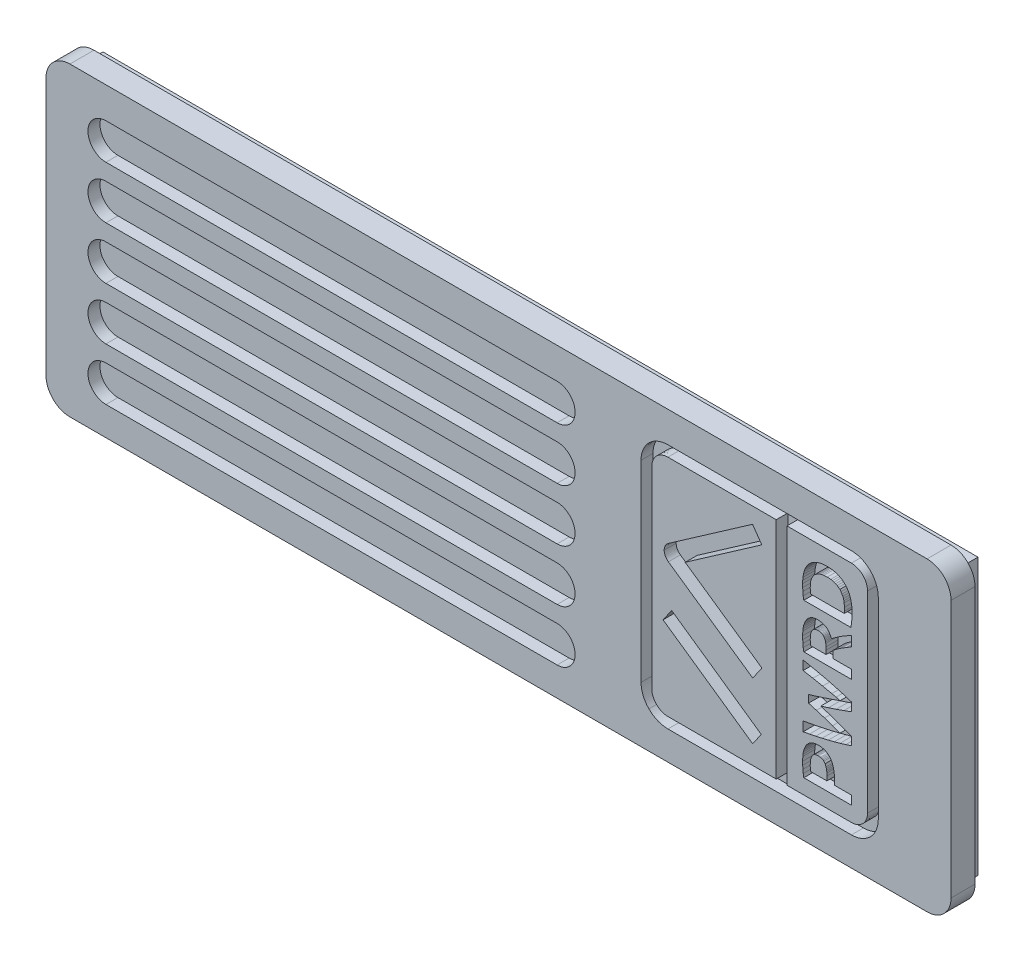
from build123d import *

# Parameters (mm, degrees)
SKETCH1_W           = 75.5
SKETCH1_H           = 25.5
BOSS_EXTRUDE1_DEPTH = 2
SKETCH2_W           = 73
SKETCH2_H           = 23
SKETCH2_W_2         = 72
SKETCH2_H_2         = 22
BOSS_EXTRUDE2_DEPTH = 1.5
FILLET1_R           = 2
CUT_EXTRUDE1_DEPTH  = 1
CUT_EXTRUDE5_DEPTH  = 1


with BuildPart() as part:
    # Sketch1 → Boss-Extrude1 (new body)
    with BuildSketch(Plane.XY):
        with Locations((2.625, -0.22972973)):
            Rectangle(SKETCH1_W, SKETCH1_H)
    extrude(amount=BOSS_EXTRUDE1_DEPTH)

    # Sketch2 → Boss-Extrude2 (add)
    with BuildSketch(Plane(origin=(0, 0, 0), x_dir=(-1, 0, 0), z_dir=(0, 0, -1))):
        with Locations((-2.625, -0.22972973)):
            Rectangle(SKETCH2_W, SKETCH2_H)
        with Locations((-2.625, -0.22972973)):
            Rectangle(SKETCH2_W_2, SKETCH2_H_2, mode=Mode.SUBTRACT)
    extrude(amount=BOSS_EXTRUDE2_DEPTH)

    # Fillet1
    fillet1_edges = [part.edges().sort_by_distance(p)[0] for p in [
        (-35.125, 12.52027027, 1),
        (40.375, 12.52027027, 1),
        (40.375, -12.97972973, 1),
        (-35.125, -12.97972973, 1),
    ]]
    fillet(fillet1_edges, radius=FILLET1_R)

    # Sketch4 → Cut-Extrude1 (cut)
    # profile 1 of 7: a face of its own
    with BuildSketch(Plane.XY.offset(2)):
        with BuildLine():
            Line((14.5143405, -8.334268667), (14.5143405, 7.712957333))
            add(Edge.make_bspline(
                [(14.5143405, 7.712957333), (14.5143405, 8.307731333), (14.7506135, 8.878144833), (15.171182, 9.298713833)],
                knots=[0, 0, 0, 0, 1, 1, 1, 1], degree=3))
            add(Edge.make_bspline(
                [(15.171182, 9.298713833), (15.591751, 9.719282333), (16.1621645, 9.955555333), (16.7569385, 9.955555333)],
                knots=[0, 0, 0, 0, 1, 1, 1, 1], degree=3))
            Line((16.7569385, 9.955555333), (32.063143, 9.955555333))
            add(Edge.make_bspline(
                [(32.063143, 9.955555333), (33.301695, 9.955553833), (34.3057385, 8.951508833), (34.3057385, 7.712957333)],
                knots=[0, 0, 0, 0, 1, 1, 1, 1], degree=3))
            Line((34.3057385, 7.712957333), (34.3057385, -8.334268667))
            add(Edge.make_bspline(
                [(34.3057385, -8.334268667), (34.3057385, -9.572820667), (33.301695, -10.576865667), (32.063143, -10.576866667)],
                knots=[0, 0, 0, 0, 1, 1, 1, 1], degree=3))
            Line((32.063143, -10.576866667), (16.7569385, -10.576866667))
            add(Edge.make_bspline(
                [(16.7569385, -10.576866667), (16.1621645, -10.576866667), (15.591751, -10.340593667), (15.171182, -9.920025167)],
                knots=[0, 0, 0, 0, 1, 1, 1, 1], degree=3))
            add(Edge.make_bspline(
                [(15.171182, -9.920025167), (14.7506135, -9.499456667), (14.5143405, -8.929042667), (14.5143405, -8.334268667)],
                knots=[0, 0, 0, 0, 1, 1, 1, 1], degree=3))
        make_face()
        with BuildLine():
            Line((26.690149, 9.058516333), (26.690149, -9.679827667))
            Line((26.690149, -9.679827667), (32.063143, -9.679827667))
            add(Edge.make_bspline(
                [(32.063143, -9.679827667), (32.8062735, -9.679826167), (33.4086995, -9.077399667), (33.4086995, -8.334268667)],
                knots=[0, 0, 0, 0, 1, 1, 1, 1], degree=3))
            Line((33.4086995, -8.334268667), (33.4086995, 7.712957333))
            add(Edge.make_bspline(
                [(33.4086995, 7.712957333), (33.4086995, 8.456087833), (32.8062735, 9.058514833), (32.063143, 9.058516333)],
                knots=[0, 0, 0, 0, 1, 1, 1, 1], degree=3))
            Line((32.063143, 9.058516333), (26.690149, 9.058516333))
        make_face(mode=Mode.SUBTRACT)
        with BuildLine():
            Line((25.79311, 9.058516333), (16.7569385, 9.058516333))
            add(Edge.make_bspline(
                [(16.7569385, 9.058516333), (16.400074, 9.058516333), (16.057826, 8.916752333), (15.8054845, 8.664411333)],
                knots=[0, 0, 0, 0, 1, 1, 1, 1], degree=3))
            add(Edge.make_bspline(
                [(15.8054845, 8.664411333), (15.5531435, 8.412069833), (15.4113795, 8.069821833), (15.4113795, 7.712957333)],
                knots=[0, 0, 0, 0, 1, 1, 1, 1], degree=3))
            Line((15.4113795, 7.712957333), (15.4113795, -8.334268667))
            add(Edge.make_bspline(
                [(15.4113795, -8.334268667), (15.4113795, -8.691133167), (15.5531435, -9.033381167), (15.8054845, -9.285722667)],
                knots=[0, 0, 0, 0, 1, 1, 1, 1], degree=3))
            add(Edge.make_bspline(
                [(15.8054845, -9.285722667), (16.057826, -9.538063667), (16.400074, -9.679827667), (16.7569385, -9.679827667)],
                knots=[0, 0, 0, 0, 1, 1, 1, 1], degree=3))
            Line((16.7569385, -9.679827667), (25.79311, -9.679827667))
            Line((25.79311, -9.679827667), (25.79311, 9.058516333))
        make_face(mode=Mode.SUBTRACT)
    # profile 2 of 7: a face of its own
    with BuildSketch(Plane.XY.offset(2)):
        Polygon((28.093961, -8.433520167), (28.0437265, -8.151121167), (28.0159185, -7.865589167), (28.001566, -7.578873167), (27.996031, -7.291834167), (28.0094865, -6.937736667), (28.0265305, -6.763371167), (28.0561325, -6.592225167), (28.1027785, -6.425307667), (28.1646745, -6.262406167), (28.2373345, -6.102208167), (28.315377, -5.943362667), (28.4170115, -5.836064167), (28.521786, -5.735226167), (28.632839, -5.647307167), (28.692044, -5.610214667), (28.7539395, -5.578755667), (28.8185265, -5.553046167), (28.8858045, -5.532405667), (29.0253835, -5.503431167), (29.170614, -5.486046667), (29.3187155, -5.474456667), (29.4759665, -5.482003667), (29.630526, -5.501989667), (29.7804215, -5.543836667), (29.9273565, -5.599686167), (30.04747, -5.671718167), (30.158434, -5.754138167), (30.2542375, -5.853792167), (30.3412505, -5.963736667), (30.419293, -6.101565167), (30.4865705, -6.243807667), (30.536805, -6.393027667), (30.5771715, -6.546242667), (30.611259, -6.741363167), (30.6363765, -6.937322167), (30.648935, -7.134592167), (30.6535275, -7.332608167), (30.6535275, -7.699578667), (32.0748135, -7.699578667), (32.0748135, -8.433520167), align=None)
        Polygon((28.7696555, -6.528767667), (28.732877, -6.604881167), (28.7014805, -6.682834167), (28.661114, -6.846228667), (28.636894, -7.042118167), (28.6293585, -7.239411667), (28.6327675, -7.469712167), (28.64712, -7.699581167), (30.021806, -7.699581167), (30.021806, -7.344260667), (30.0160555, -7.134187167), (30.0082605, -7.030123667), (29.994805, -6.927227167), (29.973276, -6.825868667), (29.9445705, -6.725997667), (29.8737045, -6.528770167), (29.764445, -6.399177667), (29.7043435, -6.344933667), (29.6370655, -6.303302167), (29.5626115, -6.275682167), (29.481878, -6.258889667), (29.3113505, -6.243353167), (29.225235, -6.247761167), (29.140913, -6.259736667), (29.0592825, -6.285086667), (28.979446, -6.319075667), (28.9166535, -6.361487667), (28.86014, -6.409362667), (28.812597, -6.466342667), align=None, mode=Mode.SUBTRACT)
    # profile 3 of 7: a face of its own
    with BuildSketch(Plane.XY.offset(2)):
        Polygon((28.487142, 7.186026833), (28.628067, 7.328279333), (28.701624, 7.394839333), (28.7796665, 7.455927833), (28.862194, 7.510378333), (28.94831, 7.559535833), (29.1275385, 7.649060333), (29.352426, 7.721989833), (29.4659015, 7.752668333), (29.580633, 7.776529833), (29.696889, 7.792496833), (29.814222, 7.802453833), (30.050771, 7.812142333), (30.28436, 7.802184833), (30.4002575, 7.792138333), (30.514989, 7.776081333), (30.628285, 7.752219833), (30.740325, 7.721630833), (30.9623425, 7.649060333), (31.1425575, 7.559132333), (31.2295705, 7.509794833), (31.312995, 7.455254833), (31.3919345, 7.394256333), (31.4663885, 7.327875333), (31.609287, 7.186044833), (31.732271, 7.019859333), (31.7887845, 6.934281333), (31.839916, 6.845654333), (31.884768, 6.753492333), (31.9242375, 6.658486833), (31.9942065, 6.463739833), (32.048926, 6.233218333), (32.09019, 6.000903333), (32.1108215, 5.765699833), (32.119164, 5.528836333), (32.1132345, 5.251992333), (32.098882, 4.975470833), (32.068383, 4.679618333), (32.0145605, 4.387147833), (28.0943825, 4.387147833), (28.04056, 4.682470833), (28.012752, 4.981283833), (28.0001935, 5.260765333), (27.9952865, 5.540479833), (28.003252, 5.774903333), (28.022987, 6.007792333), (28.062457, 6.238044833), (28.114485, 6.466645833), (28.181763, 6.660227333), (28.2194385, 6.754721333), (28.2624965, 6.846461333), (28.3118335, 6.934730333), (28.36745, 7.020128333), align=None)
        Polygon((28.629852, 5.587083833), (28.632337, 5.353817833), (28.6475865, 5.121089833), (31.4668545, 5.121089833), (31.4755915, 5.290011333), (31.478507, 5.575431333), (31.460566, 5.878836833), (31.439037, 6.026148833), (31.4031555, 6.168203833), (31.348436, 6.303387833), (31.276673, 6.432229333), (31.1932485, 6.556810333), (31.1034545, 6.679264833), (30.9862115, 6.764035333), (30.867085, 6.843512833), (30.744101, 6.912405333), (30.6154655, 6.965510333), (30.4803715, 7.000943333), (30.3403435, 7.022651833), (30.052035, 7.043283333), (29.763637, 7.024445833), (29.6234295, 7.003723833), (29.4880665, 6.969457333), (29.358893, 6.917697833), (29.2353705, 6.849971333), (29.115616, 6.771659833), (28.997745, 6.687966333), (28.908938, 6.565583333), (28.8264105, 6.441100833), (28.7555445, 6.312411833), (28.702619, 6.177461333), (28.6676345, 6.035818833), (28.6470025, 5.889072333), align=None, mode=Mode.SUBTRACT)
    # profile 4 of 7: a face of its own
    with BuildSketch(Plane.XY.offset(2)):
        Polygon((30.5462595, 1.859129833), (30.5462595, 1.393135833), (32.0723825, 1.393135833), (32.0723825, 0.659196333), (28.093961, 0.659196333), (28.0446235, 0.943162833), (28.0159185, 1.230036333), (28.001566, 1.500726833), (27.9958695, 1.771749333), (28.009325, 2.123110333), (28.026369, 2.296077333), (28.055971, 2.465797333), (28.1026175, 2.631247333), (28.164513, 2.792633833), (28.237173, 2.951283833), (28.3152155, 3.108570833), (28.414518, 3.213694833), (28.5167805, 3.312593333), (28.6251425, 3.399067833), (28.682553, 3.435667333), (28.7426545, 3.466794333), (28.8054475, 3.492359833), (28.8709315, 3.512902333), (29.007371, 3.541966333), (29.1492825, 3.559637833), (29.293975, 3.571658333), (29.485134, 3.542863333), (29.6695655, 3.504739333), (29.757475, 3.479263333), (29.8409, 3.447956833), (29.9189425, 3.409652833), (29.9916025, 3.363096833), (30.0579835, 3.307749333), (30.118085, 3.244508333), (30.1737015, 3.174449333), (30.2248325, 3.098739333), (30.3188425, 2.934903833), (30.405855, 2.762008833), (30.567053, 2.889702333), (30.7320185, 3.012479833), (30.9383375, 3.157934833), (31.148424, 3.297899833), (31.3764515, 3.441121333), (31.6086055, 3.577497833), (31.837709, 3.701755833), (32.0717465, 3.816307833), (32.0717465, 2.994996833), (31.8588795, 2.878578833), (31.6494205, 2.756168833), (31.2358855, 2.496960333), (31.0450855, 2.369571833), (30.857335, 2.237742833), (30.539873, 1.998924333), align=None)
        Polygon((28.7696555, 2.531909333), (28.732877, 2.457275333), (28.7014805, 2.380847833), (28.661114, 2.220268833), (28.636894, 2.022937833), (28.629538, 1.824172333), (28.633557, 1.608452333), (28.6470125, 1.393126833), (29.951801, 1.393126833), (29.951801, 1.713495333), (29.9454945, 1.949936833), (29.9230685, 2.185320333), (29.906922, 2.273768333), (29.885393, 2.360511833), (29.8548935, 2.444295333), (29.818115, 2.526105333), (29.7777485, 2.588000833), (29.7319995, 2.644424833), (29.676383, 2.691519333), (29.615384, 2.732962333), (29.537342, 2.764717833), (29.4575055, 2.788220333), (29.3740805, 2.799074333), (29.289759, 2.802853333), (29.2081285, 2.798737833), (29.128292, 2.787614833), (29.0511465, 2.764201833), (28.975795, 2.732895333), (28.9147965, 2.692528333), (28.85918, 2.646779333), (28.812534, 2.592060333), align=None, mode=Mode.SUBTRACT)
    # profile 5 of 7: a face of its own
    with BuildSketch(Plane.XY.offset(2)):
        Polygon((29.142447, -3.036723167), (28.4900305, -2.847412667), (28.4900305, -2.218321167), (29.1453175, -2.020272667), (29.8267985, -1.801838167), (30.4966175, -1.574663167), (31.11701, -1.356225167), (30.7759555, -1.267149167), (30.432569, -1.187312667), (29.6637165, -1.024212667), (28.8511785, -0.864028667), (28.03568, -0.715487667), (28.03568, 0.041756833), (28.564395, -0.061088667), (29.091854, -0.169639667), (29.61725, -0.287851167), (30.14139, -0.411956667), (30.627944, -0.538241667), (31.112435, -0.671694667), (31.5934275, -0.817301667), (32.072267, -0.970327667), (32.072267, -1.676602667), (31.4356115, -1.910958667), (30.795798, -2.136394667), (30.151105, -2.347519667), (29.503586, -2.550342167), (30.1755585, -2.762577167), (30.8433145, -2.987758167), (31.459042, -3.206124667), (32.0724375, -3.430998667), (32.0724375, -4.131264167), (31.5940465, -4.286283667), (31.1132335, -4.433115167), (30.628563, -4.566540167), (30.1415605, -4.692050167), (29.6171695, -4.814822667), (29.0917195, -4.931974167), (28.5642965, -5.039921167), (28.035707, -5.142435667), (28.035707, -4.356069667), (28.8453745, -4.207534167), (29.657913, -4.044436167), (30.4297255, -3.872601167), (30.774278, -3.788710167), (31.117037, -3.697857167), (30.4908135, -3.473597167), (29.8209945, -3.249337667), align=None)
    # profile 6 of 7: a face of its own
    with BuildSketch(Plane.XY.offset(2)):
        Polygon((24.5455885, -7.079788167), (23.825266, -8.111771667), (16.351082, -2.895093167), (17.071315, -1.863110167), align=None)
    # profile 7 of 7: a face of its own
    with BuildSketch(Plane.XY.offset(2)):
        with BuildLine():
            Line((16.7923985, 2.844895333), (23.8190315, 7.741067833))
            Line((23.8190315, 7.741067833), (24.5882875, 6.637087333))
            Line((24.5882875, 6.637087333), (18.1968925, 2.183547333))
            Line((18.1968925, 2.183547333), (24.598756, -2.256315167))
            Line((24.598756, -2.256315167), (23.831949, -3.361992167))
            Line((23.831949, -3.361992167), (16.7938605, 1.519099833))
            add(Edge.make_bspline(
                [(16.7938605, 1.519099833), (16.576619, 1.669762833), (16.4469075, 1.917242333), (16.446616, 2.181615333)],
                knots=[0, 0, 0, 0, 1, 1, 1, 1], degree=3))
            add(Edge.make_bspline(
                [(16.446616, 2.181615333), (16.4463245, 2.445988333), (16.57549, 2.693753333), (16.7923985, 2.844895333)],
                knots=[0, 0, 0, 0, 1, 1, 1, 1], degree=3))
        make_face()
    extrude(amount=-CUT_EXTRUDE1_DEPTH, mode=Mode.SUBTRACT)

    # Sketch6 → Cut-Extrude5 (cut)
    with BuildSketch(Plane.XY.offset(2)):
        with BuildLine():
            Line((-30.125, -7.576866667), (7.5143405, -7.576866667))
            ThreePointArc((7.5143405, -7.576866667), (9.0143405, -9.076866667), (7.5143405, -10.576866667))
            Line((7.5143405, -10.576866667), (-30.125, -10.576866667))
            ThreePointArc((-30.125, -10.576866667), (-31.625, -9.076866667), (-30.125, -7.576866667))
        make_face()
        with BuildLine():
            Line((-30.125, -6.201866667), (7.5143405, -6.201866667))
            ThreePointArc((7.5143405, -6.201866667), (9.0143405, -4.701866667), (7.5143405, -3.201866667))
            Line((7.5143405, -3.201866667), (-30.125, -3.201866667))
            ThreePointArc((-30.125, -3.201866667), (-31.625, -4.701866667), (-30.125, -6.201866667))
        make_face()
        with BuildLine():
            Line((-30.125, -1.826866667), (7.5143405, -1.826866667))
            ThreePointArc((7.5143405, -1.826866667), (9.0143405, -0.326866667), (7.5143405, 1.173133333))
            Line((7.5143405, 1.173133333), (-30.125, 1.173133333))
            ThreePointArc((-30.125, 1.173133333), (-31.625, -0.326866667), (-30.125, -1.826866667))
        make_face()
        with BuildLine():
            Line((-30.125, 2.548133333), (7.5143405, 2.548133333))
            ThreePointArc((7.5143405, 2.548133333), (9.0143405, 4.048133333), (7.5143405, 5.548133333))
            Line((7.5143405, 5.548133333), (-30.125, 5.548133333))
            ThreePointArc((-30.125, 5.548133333), (-31.625, 4.048133333), (-30.125, 2.548133333))
        make_face()
        with BuildLine():
            Line((-30.125, 6.923133333), (7.5143405, 6.923133333))
            ThreePointArc((7.5143405, 6.923133333), (9.0143405, 8.423133333), (7.5143405, 9.923133333))
            Line((7.5143405, 9.923133333), (-30.125, 9.923133333))
            ThreePointArc((-30.125, 9.923133333), (-31.625, 8.423133333), (-30.125, 6.923133333))
        make_face()
    extrude(amount=-CUT_EXTRUDE5_DEPTH, mode=Mode.SUBTRACT)


solid = part.part
